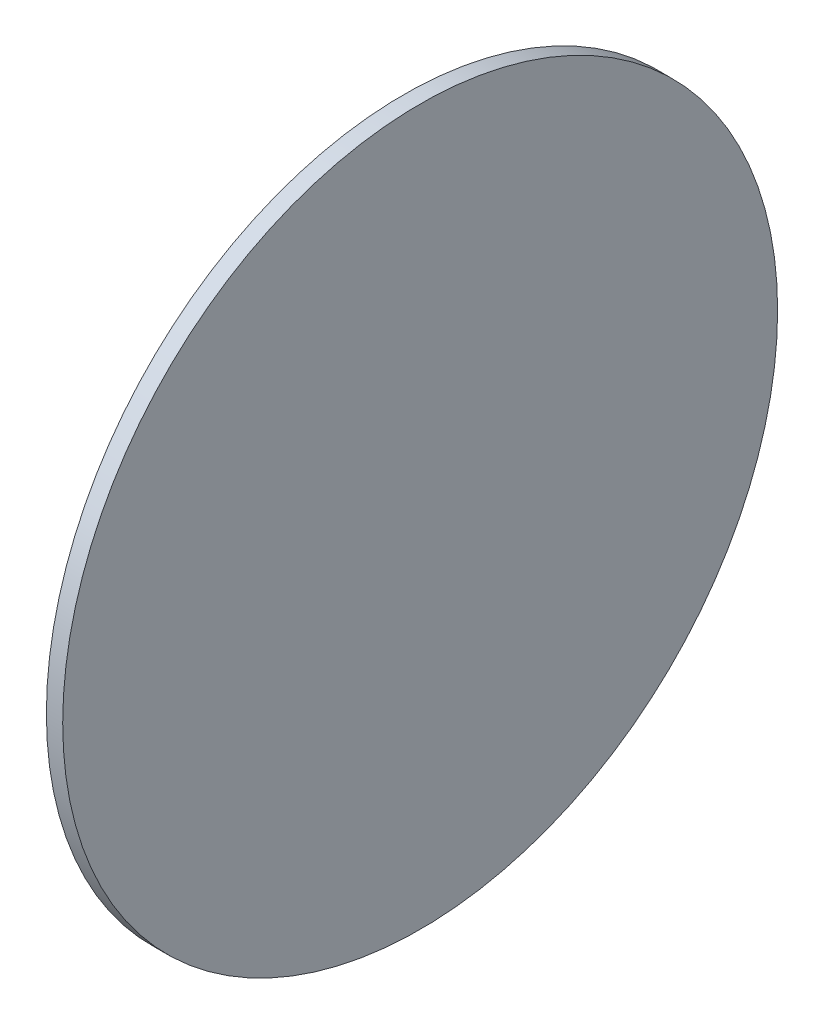
from build123d import *

# Parameters (mm, degrees)
S_CYL1_R     = 25.2
BOSS_1_DEPTH = 1.15


with BuildPart() as part:
    # S_cyl1 → Boss_1 (new body)
    with BuildSketch(Plane(origin=(0, 0, 0), x_dir=(0, 0, -1), z_dir=(1, 0, 0))):
        Circle(S_CYL1_R)
    extrude(amount=BOSS_1_DEPTH)


solid = part.part
